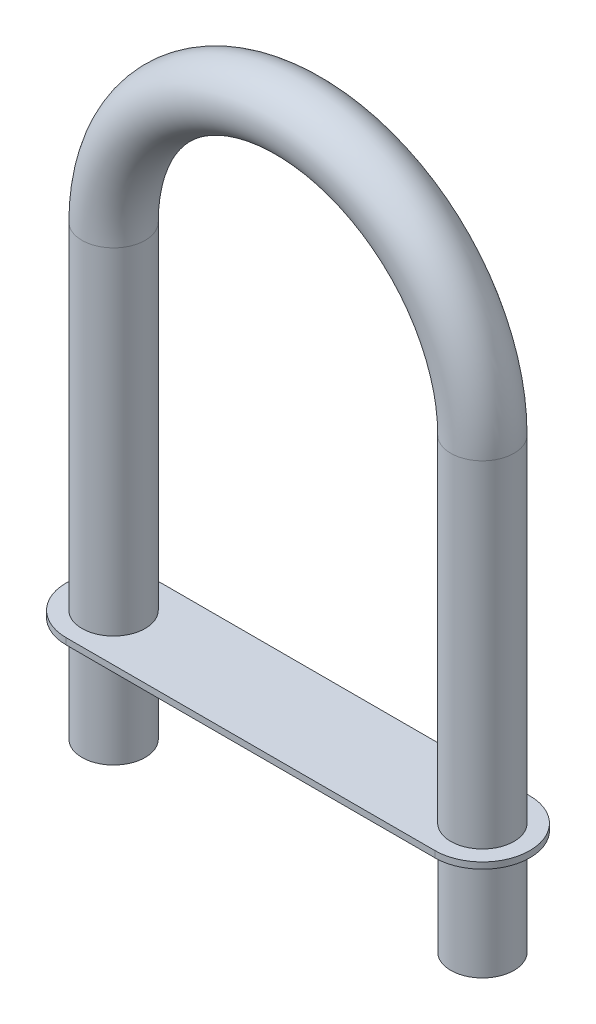
from build123d import *

# Parameters (mm, degrees)
SKETCH1_R           = 3
BOSS_EXTRUDE1_DEPTH = 0.6


with BuildPart() as part:
    # Sweep1: sweep along a path in Sketch2
    with BuildLine(Plane.XY) as sweep1_path:
        Line((-17.5, 0), (-17.5, 42.5))
        ThreePointArc((-17.5, 42.5), (0, 60), (17.5, 42.5))
        Line((17.5, 42.5), (17.5, 0))
    # Sketch1 → Sweep1 (sweep)
    with BuildSketch(Plane(origin=(0, 0, 0), x_dir=(1, 0, 0), z_dir=(0, 1, 0))):
        with Locations((-17.5, 0)):
            Circle(SKETCH1_R)
    sweep(path=sweep1_path.line)

    # Sketch3 → Boss-Extrude1 (add)
    with BuildSketch(Plane(origin=(0, 10, 0), x_dir=(1, 0, 0), z_dir=(0, 1, 0))):
        with BuildLine():
            Line((-17.5, -4.5), (17.5, -4.5))
            ThreePointArc((17.5, -4.5), (22, 0), (17.5, 4.5))
            Line((17.5, 4.5), (-17.5, 4.5))
            ThreePointArc((-17.5, 4.5), (-22, 0), (-17.5, -4.5))
        make_face()
    extrude(amount=BOSS_EXTRUDE1_DEPTH)


solid = part.part
